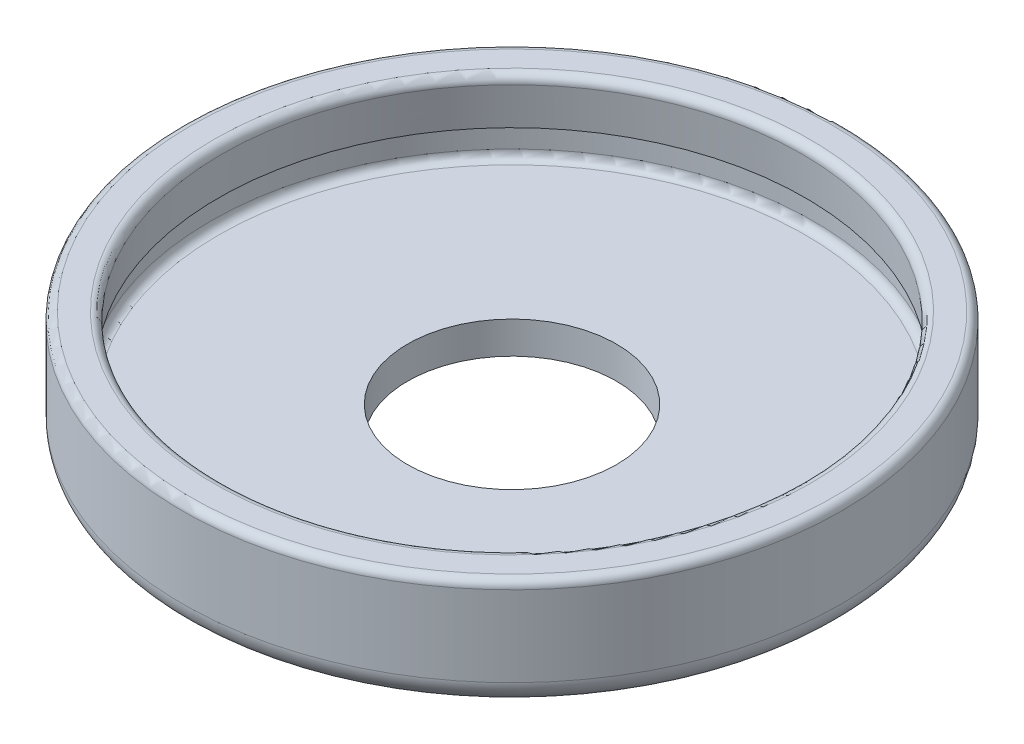
from build123d import *

# Parameters (mm, degrees)
FILLET1_R = 0.381
FILLET2_R = 0.127


with BuildPart() as part:
    # Sketch1 → Revolve1 (revolve)
    with BuildSketch(Plane.XY):
        Polygon((5.207, 1.778), (5.207, 0), (1.651, 0), (1.651, 0.508), (4.7625, 0.508), (4.7625, 1.016), (4.6355, 1.016), (4.572, 1.778), align=None)
    revolve(axis=Axis((0, -1.550453377, 0), (0, 1, 0)))

    # Fillet1
    fillet1_edges = [part.edges().sort_by_distance(p)[0] for p in [
        (-5.207, 0, 0),
    ]]
    fillet(fillet1_edges, radius=FILLET1_R)

    # Fillet2
    fillet2_edges = [part.edges().sort_by_distance(p)[0] for p in [
        (-4.572, 1.778, 0),
        (-5.207, 1.778, 0),
        (-4.7625, 0.508, 0),
    ]]
    fillet(fillet2_edges, radius=FILLET2_R)


solid = part.part
